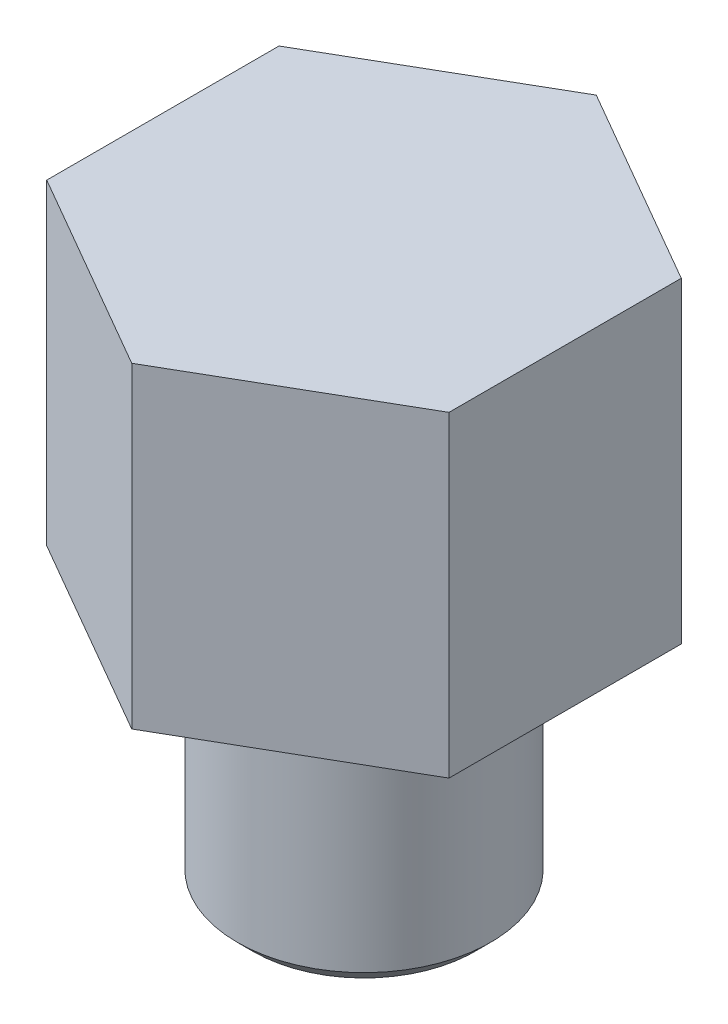
from build123d import *

# Parameters (mm, degrees)
BOSS_EXTRUDE1_DEPTH = 18
SKETCH2_R           = 11.041955005
SKETCH2_R_2         = 4
CUT_EXTRUDE1_DEPTH  = 8
CHAMFER1_SIZE       = 0.5
FILLET1_R           = 0.5


with BuildPart() as part:
    # Sketch1 → Boss-Extrude1 (new body)
    with BuildSketch(Plane(origin=(0, 0, 0), x_dir=(1, 0, 0), z_dir=(0, 1, 0))):
        Polygon((6.35, 3.666174209), (0, 7.332348419), (-6.35, 3.666174209), (-6.35, -3.666174209), (0, -7.332348419), (6.35, -3.666174209), align=None)
    extrude(amount=BOSS_EXTRUDE1_DEPTH)

    # Sketch2 → Cut-Extrude1 (cut)
    with BuildSketch(Plane.XZ):
        Circle(SKETCH2_R)
        with Locations(Location((0, 0, 0), (0, 0, 270))):
            Circle(SKETCH2_R_2, mode=Mode.SUBTRACT)
    extrude(amount=-CUT_EXTRUDE1_DEPTH, mode=Mode.SUBTRACT)

    # Chamfer1
    chamfer1_edges = [part.edges().sort_by_distance(p)[0] for p in [
        (0, 0, 4),
    ]]
    chamfer(chamfer1_edges, length=CHAMFER1_SIZE)

    # Fillet1
    fillet1_edges = [part.edges().sort_by_distance(p)[0] for p in [
        (0, 8, 4),
    ]]
    fillet(fillet1_edges, radius=FILLET1_R)


solid = part.part
